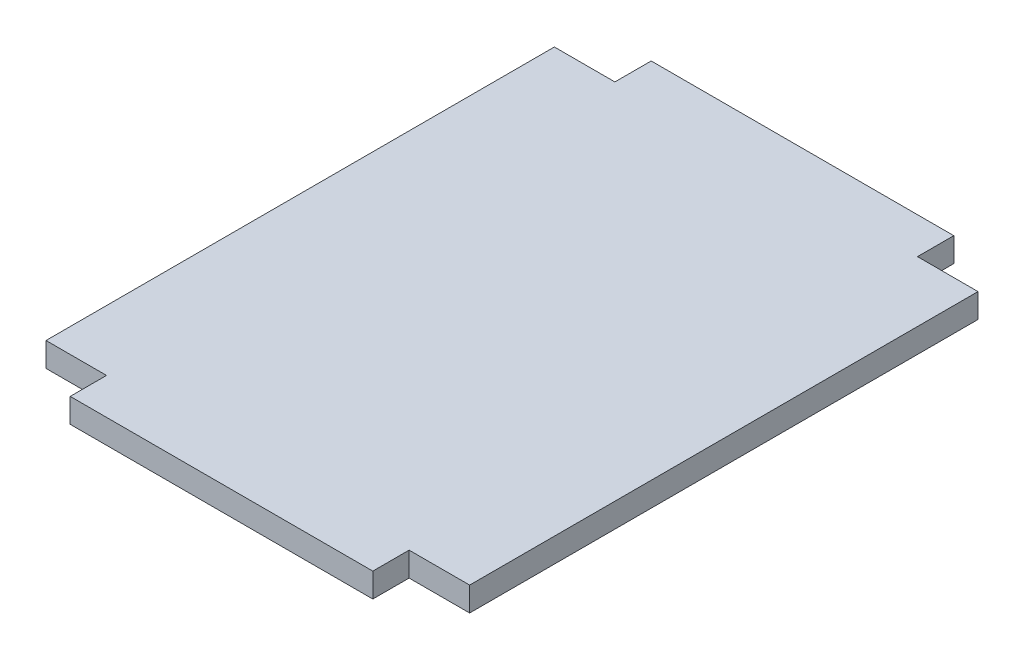
from build123d import *

# Parameters (mm, degrees)
ESTRUSIONE_ESTRUSIONE1_DEPTH      = 45
ESTRUSIONE_ESTRUSIONE1_DEPTH_BACK = 3
SCHIZZO1_W                        = 25
SCHIZZO1_H                        = 2
SCHIZZO2_W                        = 42
SCHIZZO2_H                        = 2
ESTRUSIONE_ESTRUSIONE2_DEPTH      = 5


with BuildPart() as part:
    # Schizzo1 → Estrusione-Estrusione1 (new, two sides: drawn at the far end of the back side and taken through both)
    with BuildSketch(Plane.XY.offset(-ESTRUSIONE_ESTRUSIONE1_DEPTH_BACK)):
        with Locations((35.5, -54.5)):
            Rectangle(SCHIZZO1_W, SCHIZZO1_H)
    extrude(amount=ESTRUSIONE_ESTRUSIONE1_DEPTH + ESTRUSIONE_ESTRUSIONE1_DEPTH_BACK)

    # Schizzo2 → Estrusione-Estrusione2 (add)
    with BuildSketch(Plane(origin=(48, 0, 0), x_dir=(0, 0, -1), z_dir=(1, 0, 0))):
        with Locations((-21, -54.5)):
            Rectangle(SCHIZZO2_W, SCHIZZO2_H)
    estrusione_estrusione2 = extrude(amount=ESTRUSIONE_ESTRUSIONE2_DEPTH)

    # Specchia1: Estrusione-Estrusione2 across plane
    add(estrusione_estrusione2.mirror(Plane(origin=(35.5, 0, 0), x_dir=(0, 0, 1), z_dir=(1, 0, 0))))


solid = part.part
